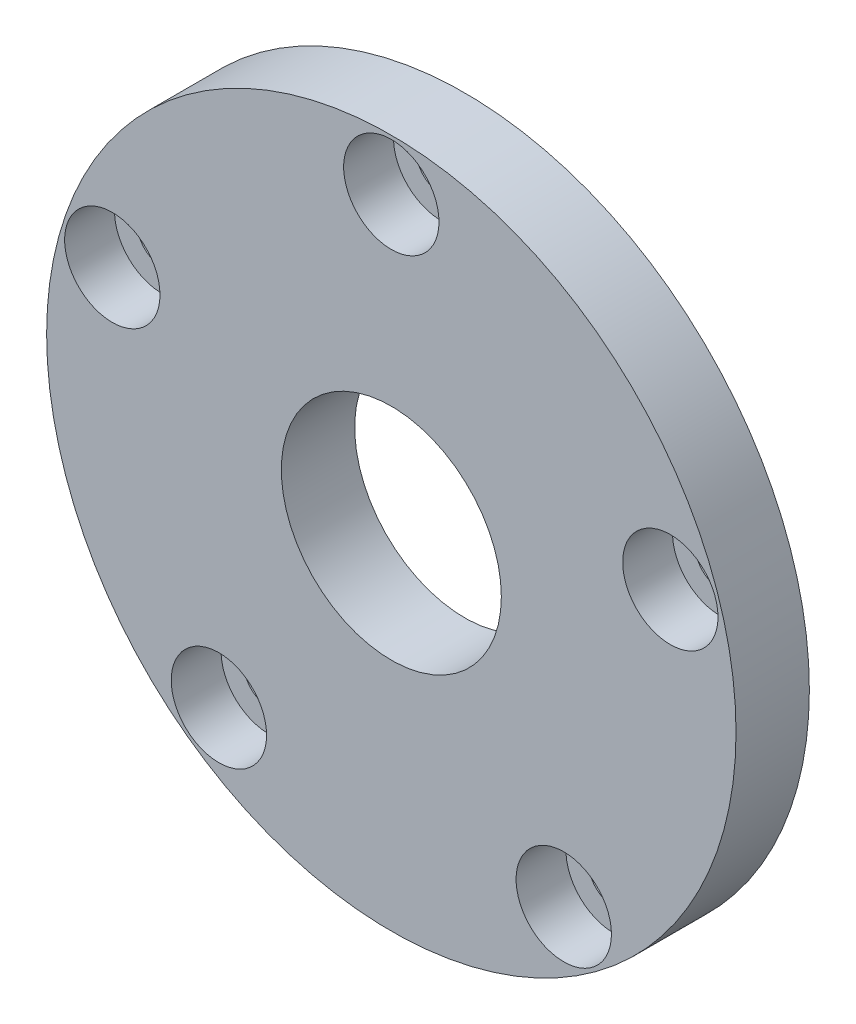
from build123d import *

# Parameters (mm, degrees)
SKETCH1_R               = 23.5
BOSS_EXTRUDE1_DEPTH     = 5
CUT_EXTRUDE1_DEPTH      = 34.608034754
CUT_EXTRUDE1_DEPTH_BACK = 34.608034754
SKETCH5_R               = 7.5
CIRPATTERN1_COUNT       = 5


with BuildPart() as part:
    # Sketch1 → Boss-Extrude1 (new body)
    with BuildSketch(Plane.XY):
        Circle(SKETCH1_R)
    extrude(amount=BOSS_EXTRUDE1_DEPTH)

    # Sketch5 → Cut-Extrude1 (cut, two sides: drawn at the far end of the back side and taken through both)
    with BuildSketch(Plane.XY.offset(5).offset(-CUT_EXTRUDE1_DEPTH_BACK)):
        Circle(SKETCH5_R)
    extrude(amount=CUT_EXTRUDE1_DEPTH + CUT_EXTRUDE1_DEPTH_BACK, mode=Mode.SUBTRACT)

    # Sketch3 → CBORE for M3 Hex Socket Head Cap Screw1 (revolve, cut)
    with BuildSketch(Plane(origin=(0, 20, 5), x_dir=(0, -1, 0), z_dir=(1, 0, 0))):
        Polygon((0, 0), (0, 16.021463052), (1.7, 15), (1.7, 3.4), (3.25, 3.4), (3.25, 0), align=None)
    cbore_for_m3_hex_socket_head_cap_screw1 = revolve(axis=Axis((0, 20, 11.35), (0, 0, -1)), mode=Mode.SUBTRACT)

    # CirPattern1: CBORE for M3 Hex Socket Head Cap Screw1 ×5 about axis
    cirpattern1_axis = Axis((0, 0, 0), (0, 0, 1))
    for i in range(1, CIRPATTERN1_COUNT):
        add(cbore_for_m3_hex_socket_head_cap_screw1.rotate(cirpattern1_axis, i * 360 / CIRPATTERN1_COUNT), mode=Mode.SUBTRACT)


solid = part.part
